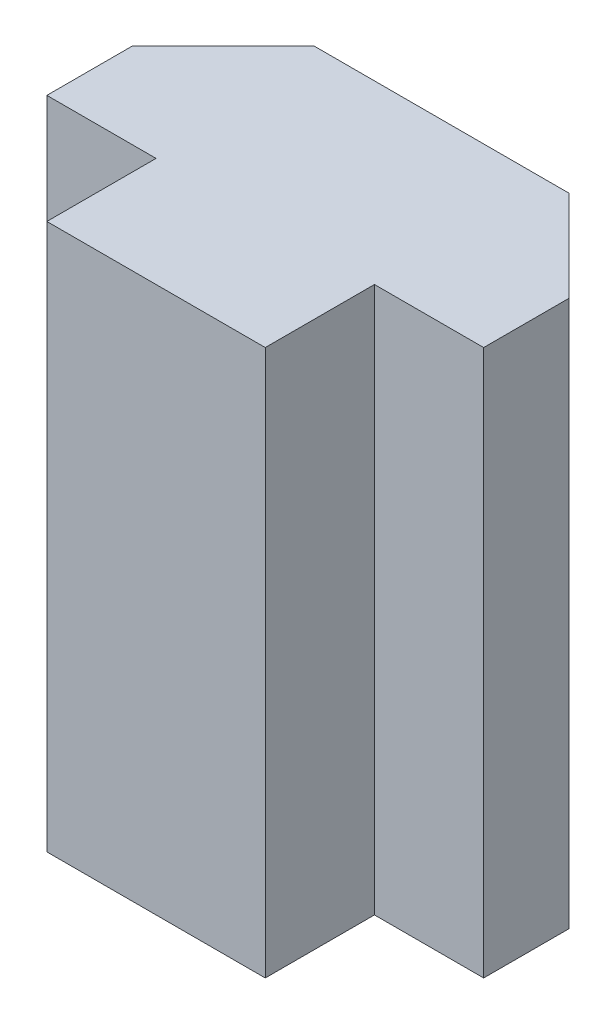
from build123d import *

# Parameters (mm, degrees)
BOSS_EXTRUDE1_DEPTH          = 40
SKETCH2_W                    = 3.5
SKETCH2_H                    = 40
BOSS_EXTRUDE2_DEPTH          = 5
SKETCH4_R                    = 2
CUT_EXTRUDE1_DEPTH           = 7
SKETCH5_R                    = 3.5
CUT_EXTRUDE2_DEPTH           = 3
CUT_EXTRUDE2_DRAFT           = -27
CUT_EXTRUDE2_PROFILE_2_DEPTH = 3
CUT_EXTRUDE2_PROFILE_2_DRAFT = -27
BOSS_EXTRUDE3_DEPTH          = 3
SKETCH9_W                    = 13
SKETCH9_H                    = 40
CUT_EXTRUDE4_DEPTH           = 4.702585656
SKETCH10_W                   = 15
SKETCH10_H                   = 40
BOSS_EXTRUDE4_DEPTH          = 2.5
SKETCH11_W                   = 1.5
SKETCH11_H                   = 2.202585656
BOSS_EXTRUDE7_DEPTH          = 40
BOSS_EXTRUDE8_DEPTH          = 0.625841469
SKETCH13_R                   = 2
CUT_EXTRUDE5_DEPTH           = 10
SKETCH14_W                   = 2.5
SKETCH14_H                   = 40
BOSS_EXTRUDE9_DEPTH          = 0.5
SKETCH15_W                   = 2.5
SKETCH15_H                   = 40
BOSS_EXTRUDE10_DEPTH         = 0.5
BOSS_EXTRUDE11_DEPTH         = 40
BOSS_EXTRUDE12_DEPTH         = 1.13137085
SKETCH18_R                   = 2
CUT_EXTRUDE6_DEPTH           = 10
SKETCH19_R                   = 3
CUT_EXTRUDE7_DEPTH           = 3
CUT_EXTRUDE7_DRAFT           = -19
CUT_EXTRUDE7_PROFILE_2_DEPTH = 3
CUT_EXTRUDE7_PROFILE_2_DRAFT = -19
SKETCH20_W                   = 5
SKETCH20_H                   = 40
BOSS_EXTRUDE13_DEPTH         = 0.5
SKETCH21_W                   = 5
SKETCH21_H                   = 40
BOSS_EXTRUDE14_DEPTH         = 0.5
SKETCH22_W                   = 7
SKETCH22_H                   = 6.5
SKETCH22_W_2                 = 7.5
CUT_EXTRUDE8_DEPTH           = 20
SKETCH23_R                   = 2
BOSS_EXTRUDE15_DEPTH         = 6.459797975
SKETCH24_R                   = 3
BOSS_EXTRUDE16_DEPTH         = 11.459797975
SKETCH25_W                   = 4
SKETCH25_H                   = 20
CUT_EXTRUDE9_DEPTH           = 20
SKETCH26_W                   = 8
SKETCH26_H                   = 20
CUT_EXTRUDE10_DEPTH          = 1


with BuildPart() as part:
    # Sketch1 → Boss-Extrude1 (new body)
    with BuildSketch(Plane(origin=(0, 0, 0), x_dir=(1, 0, 0), z_dir=(0, 1, 0))):
        Polygon((-4.247892457, 4.702585656), (8.752107543, 4.702585656), (8.752107543, 1.702585656), (7.049521887, 0), (-2.545306801, 0), (-4.247892457, 1.702585656), align=None)
    extrude(amount=BOSS_EXTRUDE1_DEPTH)

    # Sketch2 → Boss-Extrude2 (add)
    with BuildSketch(Plane.XY):
        with Locations((4.002107543, 20)):
            Rectangle(SKETCH2_W, SKETCH2_H)
        with Locations((0.502107543, 20)):
            Rectangle(SKETCH2_W, SKETCH2_H)
    extrude(amount=BOSS_EXTRUDE2_DEPTH)

    # Sketch4 → Cut-Extrude1 (cut)
    with BuildSketch(Plane.XY.offset(5)):
        with Locations((2.252107543, 30)):
            Circle(SKETCH4_R)
        with Locations((2.252107543, 10)):
            Circle(SKETCH4_R)
    extrude(amount=-CUT_EXTRUDE1_DEPTH, mode=Mode.SUBTRACT)


with BuildPart() as cut_extrude2_tool:
    # Sketch5 → Cut-Extrude2 (with draft: the straight prism first)
    with BuildSketch(Plane(origin=(0, 0, -4.702585656), x_dir=(-1, 0, 0), z_dir=(0, 0, -1))):
        with Locations((-2.252107543, 30)):
            Circle(SKETCH5_R)
    extrude(amount=-CUT_EXTRUDE2_DEPTH)
    # Cut-Extrude2: the draft: its side faces are tilted about the plane it starts from
    cut_extrude2_sides = [cut_extrude2_tool.faces().sort_by_distance(p)[0] for p in [
        (5.752107543, 30, -3.202585656),
    ]]
    draft(cut_extrude2_sides, Plane(origin=(0, 0, -4.702585656), x_dir=(-1, 0, 0), z_dir=(0, 0, -1)), CUT_EXTRUDE2_DRAFT)


with BuildPart() as part_1:
    add(part.part)

    # Cut-Extrude2: cut by cut_extrude2_tool
    add(cut_extrude2_tool.part, mode=Mode.SUBTRACT)


with BuildPart() as cut_extrude2_profile_2_tool:
    # Sketch5 → Cut-Extrude2 profile 2 (with draft: the straight prism first)
    with BuildSketch(Plane(origin=(0, 0, -4.702585656), x_dir=(-1, 0, 0), z_dir=(0, 0, -1))):
        with Locations((-2.252107543, 10)):
            Circle(SKETCH5_R)
    extrude(amount=-CUT_EXTRUDE2_PROFILE_2_DEPTH)
    # Cut-Extrude2 profile 2: the draft: its side faces are tilted about the plane it starts from
    cut_extrude2_profile_2_sides = [cut_extrude2_profile_2_tool.faces().sort_by_distance(p)[0] for p in [
        (5.752107543, 10, -3.202585656),
    ]]
    draft(cut_extrude2_profile_2_sides, Plane(origin=(0, 0, -4.702585656), x_dir=(-1, 0, 0), z_dir=(0, 0, -1)), CUT_EXTRUDE2_PROFILE_2_DRAFT)


with BuildPart() as part_2:
    add(part_1.part)

    # Cut-Extrude2 profile 2: cut by cut_extrude2_profile_2_tool
    add(cut_extrude2_profile_2_tool.part, mode=Mode.SUBTRACT)

    # Sketch7 → Boss-Extrude3 (add)
    with BuildSketch(Plane(origin=(0, 0, -4.702585656), x_dir=(-1, 0, 0), z_dir=(0, 0, -1))):
        Polygon((1.247892457, 46.5), (-5.752107543, 46.5), (-5.752107543, 40), (-4.252107543, 40), (-4.252107543, 45), (-0.252107543, 45), (-0.252107543, 43.275204256), (-0.252107543, 40), (1.247892457, 40), align=None)
        Polygon((-4.252107543, 0), (-5.752107543, 0), (-5.752107543, -6.5), (1.247892457, -6.5), (1.247892457, 0), (-0.252107543, 0), (-0.252107543, -5), (-4.252107543, -5), align=None)
    extrude(amount=-BOSS_EXTRUDE3_DEPTH)

    # Sketch9 → Cut-Extrude4 (cut)
    with BuildSketch(Plane(origin=(0, 0, -4.702585656), x_dir=(-1, 0, 0), z_dir=(0, 0, -1))):
        with Locations((-2.252107543, 20)):
            Rectangle(SKETCH9_W, SKETCH9_H)
    extrude(amount=-CUT_EXTRUDE4_DEPTH, mode=Mode.SUBTRACT)


with BuildPart() as cut_extrude4_piece_1:
    # of the separate pieces the step leaves, piece 1, a body of its own (cut_extrude4_pieces)
    add(part_2.part.solids().sort_by_distance((-1.247892457, 0, 0))[0])



with BuildPart() as cut_extrude4_piece_2:
    # of the separate pieces the step leaves, piece 2, a body of its own (cut_extrude4_pieces)
    add(part_2.part.solids().sort_by_distance((0.252107543, 40, -4.702585656))[0])


with BuildPart() as cut_extrude4_piece_3:
    # of the separate pieces the step leaves, piece 3, a body of its own (cut_extrude4_pieces)
    add(part_2.part.solids().sort_by_distance((-1.247892457, -6.5, -4.702585656))[0])


with BuildPart() as cut_extrude4_piece_1_1:
    add(cut_extrude4_piece_1.part)

    add(cut_extrude4_piece_2.part)  # Boss-Extrude4 merges Cut-Extrude4 piece 2

    add(cut_extrude4_piece_3.part)  # Boss-Extrude4 merges Cut-Extrude4 piece 3
    # Sketch10 → Boss-Extrude4 (add)
    with BuildSketch(Plane(origin=(0, 0, 0), x_dir=(-1, 0, 0), z_dir=(0, 0, -1))):
        with Locations((-2.252107543, 20)):
            Rectangle(SKETCH10_W, SKETCH10_H)
    extrude(amount=BOSS_EXTRUDE4_DEPTH)

    # Sketch11 → Boss-Extrude7 (add)
    with BuildSketch(Plane(origin=(0, 0, 0), x_dir=(1, 0, 0), z_dir=(0, 1, 0))):
        with Locations((5.002107543, 3.601292828)):
            Rectangle(SKETCH11_W, SKETCH11_H)
        Polygon((-2.419465332, 5.328427125), (-5.247892457, 2.5), (4.252107543, 2.5), (4.252107543, 4.702585656), (5.752107543, 4.702585656), (5.752107543, 2.5), (9.752107543, 2.5), (6.923680418, 5.328427125), align=None)
    extrude(amount=BOSS_EXTRUDE7_DEPTH)

    # Sketch12 → Boss-Extrude8 (add)
    with BuildSketch(Plane(origin=(0, 0, -4.702585656), x_dir=(-1, 0, 0), z_dir=(0, 0, -1))):
        Polygon((-5.752107543, 0), (-5.752107543, -6.5), (1.247892457, -6.5), (1.247892457, 0), (-0.252107543, 0), (-0.252107543, -5), (-4.252107543, -5), (-4.252107543, 0), align=None)
        Polygon((1.247892457, 46.5), (-5.752107543, 46.5), (-5.752107543, 40), (-4.252107543, 40), (-4.252107543, 45), (-0.252107543, 45), (-0.252107543, 40), (1.247892457, 40), align=None)
    extrude(amount=BOSS_EXTRUDE8_DEPTH)

    # Sketch13 → Cut-Extrude5 (cut)
    with BuildSketch(Plane.XY):
        with Locations((2.252107543, 30)):
            Circle(SKETCH13_R)
        with Locations((2.252107543, 10)):
            Circle(SKETCH13_R)
    extrude(amount=-CUT_EXTRUDE5_DEPTH, mode=Mode.SUBTRACT)

    # Sketch14 → Boss-Extrude9 (add)
    with BuildSketch(Plane(origin=(9.752107543, 0, 0), x_dir=(0, 0, -1), z_dir=(1, 0, 0))):
        with Locations((1.25, 20)):
            Rectangle(SKETCH14_W, SKETCH14_H)
    extrude(amount=BOSS_EXTRUDE9_DEPTH)

    # Sketch15 → Boss-Extrude10 (add)
    with BuildSketch(Plane.ZY.offset(5.247892457)):
        with Locations((-1.25, 20)):
            Rectangle(SKETCH15_W, SKETCH15_H)
    extrude(amount=BOSS_EXTRUDE10_DEPTH)

    # Sketch16 → Boss-Extrude11 (add)
    with BuildSketch(Plane.XZ):
        Polygon((-2.419465332, -5.328427125), (-5.247892457, -2.5), (-5.747892457, -2.5), (-5.747892457, -3.13137085), (-2.419465332, -6.459797975), (6.923680418, -6.459797975), (10.252107543, -3.13137085), (10.252107543, -2.5), (9.752107543, -2.5), (6.923680418, -5.328427125), (0.656985658, -5.328427125), align=None)
    extrude(amount=-BOSS_EXTRUDE11_DEPTH)

    # Sketch17 → Boss-Extrude12 (add)
    with BuildSketch(Plane(origin=(0, 0, -5.328427125), x_dir=(-1, 0, 0), z_dir=(0, 0, -1))):
        Polygon((-5.752107543, 0), (-5.752107543, -6.5), (1.247892457, -6.5), (1.247892457, 0), (0, 0), (0, -5), (-0.252107543, -5), (-4.252107543, -5), (-4.252107543, 0), align=None)
        Polygon((1.247892457, 46.5), (-5.752107543, 46.5), (-5.752107543, 40), (-4.252107543, 40), (-4.252107543, 44.953142187), (-0.252107543, 44.953142187), (-0.252107543, 40), (1.247892457, 40), align=None)
    extrude(amount=BOSS_EXTRUDE12_DEPTH)

    # Sketch18 → Cut-Extrude6 (cut)
    with BuildSketch(Plane.XY.offset(-5.328427125)):
        with Locations((2.252107543, 30)):
            Circle(SKETCH18_R)
        with Locations((2.252107543, 10)):
            Circle(SKETCH18_R)
    extrude(amount=-CUT_EXTRUDE6_DEPTH, mode=Mode.SUBTRACT)


with BuildPart() as cut_extrude7_tool:
    # Sketch19 → Cut-Extrude7 (with draft: the straight prism first)
    with BuildSketch(Plane(origin=(0, 0, -6.459797975), x_dir=(-1, 0, 0), z_dir=(0, 0, -1))):
        with Locations((-2.252107543, 30)):
            Circle(SKETCH19_R)
    extrude(amount=-CUT_EXTRUDE7_DEPTH)
    # Cut-Extrude7: the draft: its side faces are tilted about the plane it starts from
    cut_extrude7_sides = [cut_extrude7_tool.faces().sort_by_distance(p)[0] for p in [
        (5.252107543, 30, -4.959797975),
    ]]
    draft(cut_extrude7_sides, Plane(origin=(0, 0, -6.459797975), x_dir=(-1, 0, 0), z_dir=(0, 0, -1)), CUT_EXTRUDE7_DRAFT)


with BuildPart() as cut_extrude4_piece_1_2:
    add(cut_extrude4_piece_1_1.part)

    # Cut-Extrude7: cut by cut_extrude7_tool
    add(cut_extrude7_tool.part, mode=Mode.SUBTRACT)


with BuildPart() as cut_extrude7_profile_2_tool:
    # Sketch19 → Cut-Extrude7 profile 2 (with draft: the straight prism first)
    with BuildSketch(Plane(origin=(0, 0, -6.459797975), x_dir=(-1, 0, 0), z_dir=(0, 0, -1))):
        with Locations((-2.252107543, 10)):
            Circle(SKETCH19_R)
    extrude(amount=-CUT_EXTRUDE7_PROFILE_2_DEPTH)
    # Cut-Extrude7 profile 2: the draft: its side faces are tilted about the plane it starts from
    cut_extrude7_profile_2_sides = [cut_extrude7_profile_2_tool.faces().sort_by_distance(p)[0] for p in [
        (5.252107543, 10, -4.959797975),
    ]]
    draft(cut_extrude7_profile_2_sides, Plane(origin=(0, 0, -6.459797975), x_dir=(-1, 0, 0), z_dir=(0, 0, -1)), CUT_EXTRUDE7_PROFILE_2_DRAFT)


with BuildPart() as cut_extrude4_piece_1_3:
    add(cut_extrude4_piece_1_2.part)

    # Cut-Extrude7 profile 2: cut by cut_extrude7_profile_2_tool
    add(cut_extrude7_profile_2_tool.part, mode=Mode.SUBTRACT)

    # Sketch20 → Boss-Extrude13 (add)
    with BuildSketch(Plane.ZY.offset(1.247892457)):
        with Locations((2.5, 20)):
            Rectangle(SKETCH20_W, SKETCH20_H)
    extrude(amount=BOSS_EXTRUDE13_DEPTH)

    # Sketch21 → Boss-Extrude14 (add)
    with BuildSketch(Plane(origin=(5.752107543, 0, 0), x_dir=(0, 0, -1), z_dir=(1, 0, 0))):
        with Locations((-2.5, 20)):
            Rectangle(SKETCH21_W, SKETCH21_H)
    extrude(amount=BOSS_EXTRUDE14_DEPTH)

    # Sketch22 → Cut-Extrude8 (cut)
    with BuildSketch(Plane.XY.offset(5)):
        with Locations((2.252107543, 43.25)):
            Rectangle(SKETCH22_W, SKETCH22_H)
        with Locations((2.502107543, -3.25)):
            Rectangle(SKETCH22_W_2, SKETCH22_H)
    extrude(amount=-CUT_EXTRUDE8_DEPTH, mode=Mode.SUBTRACT)

    # Sketch23 → Boss-Extrude15 (add)
    with BuildSketch(Plane.XY):
        with Locations((2.252107543, 10)):
            Circle(SKETCH23_R)
        with Locations((2.252107543, 30)):
            Circle(SKETCH23_R)
    extrude(amount=-BOSS_EXTRUDE15_DEPTH)

    # Sketch24 → Boss-Extrude16 (add)
    with BuildSketch(Plane(origin=(0, 0, -6.459797975), x_dir=(-1, 0, 0), z_dir=(0, 0, -1))):
        with Locations((-2.252107543, 30)):
            Circle(SKETCH24_R)
        with Locations((-2.252107543, 10)):
            Circle(SKETCH24_R)
    extrude(amount=-BOSS_EXTRUDE16_DEPTH)

    # Sketch25 → Cut-Extrude9 (cut)
    with BuildSketch(Plane.XY.offset(5)):
        Polygon((6.252107543, 20.358230215), (6.252107543, 20), (10.252107543, 20), (10.252107543, 40), (6.252107543, 40), align=None)
        Polygon((-1.747892457, 20), (6.252107543, 20), (6.252107543, 20.358230215), (6.252107543, 40), (-1.747892457, 40), align=None)
        with Locations((-3.747892457, 30)):
            Rectangle(SKETCH25_W, SKETCH25_H)
    extrude(amount=-CUT_EXTRUDE9_DEPTH, mode=Mode.SUBTRACT)

    # Sketch26 → Cut-Extrude10 (cut)
    with BuildSketch(Plane.XY.offset(5)):
        with Locations((2.252107543, 10)):
            Rectangle(SKETCH26_W, SKETCH26_H)
    extrude(amount=-CUT_EXTRUDE10_DEPTH, mode=Mode.SUBTRACT)


solid = cut_extrude4_piece_1_3.part
